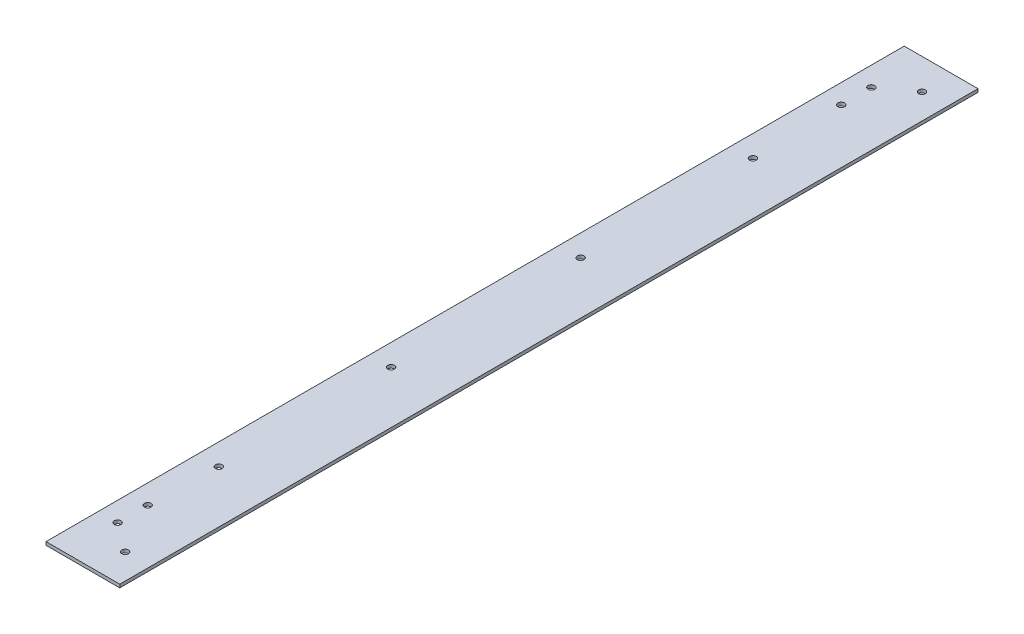
from build123d import *

# Parameters (mm, degrees)
CROQUIS1_W              = 35
CROQUIS1_H              = 400
SALIENTE_EXTRUIR1_DEPTH = 1.5
CROQUIS2_R              = 1.55
CORTAR_EXTRUIR1_DEPTH   = 1.5
CROQUIS3_R              = 1.55
CORTAR_EXTRUIR2_DEPTH   = 1.5
CROQUIS5_R              = 1.55
CORTAR_EXTRUIR3_DEPTH   = 1.5
CROQUIS6_OUTSIDE_W      = 117.306
CROQUIS6_OUTSIDE_H      = 482.306
CROQUIS6_OUTSIDE_W_2    = 33.5
CROQUIS6_OUTSIDE_H_2    = 398.5
CORTAR_EXTRUIR4_DEPTH   = 1.5
CROQUIS7_W              = 0.75
CROQUIS7_H              = 398.5
SALIENTE_EXTRUIR2_DEPTH = 1.5


with BuildPart() as part:
    # Croquis1 → Saliente-Extruir1 (new body)
    with BuildSketch(Plane(origin=(0, 0, 0), x_dir=(1, 0, 0), z_dir=(0, 1, 0))):
        with Locations((17.5, -200)):
            Rectangle(CROQUIS1_W, CROQUIS1_H)
    extrude(amount=SALIENTE_EXTRUIR1_DEPTH)

    # Croquis2 → Cortar-Extruir1 (cut)
    with BuildSketch(Plane(origin=(0, 1.5, 0), x_dir=(1, 0, 0), z_dir=(0, 1, 0))):
        with Locations(Location((22.5, -15, 0), (0, 0, 270))):
            Circle(CROQUIS2_R)
        with Locations(Location((22.5, -385, 0), (0, 0, 270))):
            Circle(CROQUIS2_R)
    extrude(amount=-CORTAR_EXTRUIR1_DEPTH, mode=Mode.SUBTRACT)

    # Croquis3 → Cortar-Extruir2 (cut)
    with BuildSketch(Plane(origin=(0, 1.5, 0), x_dir=(1, 0, 0), z_dir=(0, 1, 0))):
        with Locations(Location((9, -25, 0), (0, 0, 270))):
            Circle(CROQUIS3_R)
        with Locations(Location((9, -39, 0), (0, 0, 270))):
            Circle(CROQUIS3_R)
        with Locations(Location((9, -375, 0), (0, 0, 270))):
            Circle(CROQUIS3_R)
        with Locations(Location((9, -361, 0), (0, 0, 270))):
            Circle(CROQUIS3_R)
    extrude(amount=-CORTAR_EXTRUIR2_DEPTH, mode=Mode.SUBTRACT)

    # Croquis5 → Cortar-Extruir3 (cut)
    with BuildSketch(Plane(origin=(0, 1.5, 0), x_dir=(1, 0, 0), z_dir=(0, 1, 0))):
        with Locations(Location((10, -81, 0), (0, 0, 270))):
            Circle(CROQUIS5_R)
        with Locations(Location((10, -161, 0), (0, 0, 270))):
            Circle(CROQUIS5_R)
        with Locations(Location((10, -249, 0), (0, 0, 270))):
            Circle(CROQUIS5_R)
        with Locations(Location((10, -329, 0), (0, 0, 270))):
            Circle(CROQUIS5_R)
    extrude(amount=-CORTAR_EXTRUIR3_DEPTH, mode=Mode.SUBTRACT)

    # Croquis6 outside → Cortar-Extruir4 (cut)
    with BuildSketch(Plane(origin=(0, 1.5, 0), x_dir=(1, 0, 0), z_dir=(0, 1, 0))):
        with Locations((17.5, -200)):
            Rectangle(CROQUIS6_OUTSIDE_W, CROQUIS6_OUTSIDE_H)
        with Locations((17.5, -200)):
            Rectangle(CROQUIS6_OUTSIDE_W_2, CROQUIS6_OUTSIDE_H_2, mode=Mode.SUBTRACT)
    extrude(amount=-CORTAR_EXTRUIR4_DEPTH, mode=Mode.SUBTRACT)

    # Croquis7 → Saliente-Extruir2 (add)
    with BuildSketch(Plane(origin=(0, 1.5, 0), x_dir=(1, 0, 0), z_dir=(0, 1, 0))):
        with Locations((0.375, -200)):
            Rectangle(CROQUIS7_W, CROQUIS7_H)
    extrude(amount=-SALIENTE_EXTRUIR2_DEPTH)


solid = part.part
